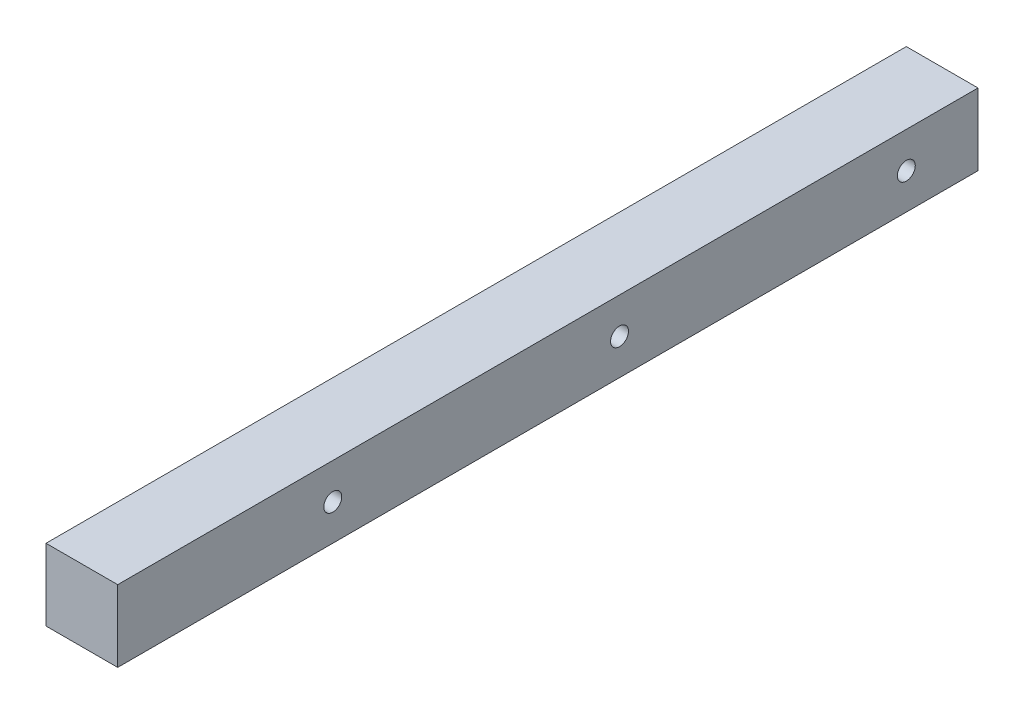
from build123d import *

# Parameters (mm, degrees)
SKETCH7_W           = 25.4
SKETCH7_H           = 25.4
BOSS_EXTRUDE3_DEPTH = 152.4
SKETCH9_R           = 3.175
CUT_EXTRUDE1_DEPTH  = 156.02325632
LPATTERN1_COUNT     = 2
LPATTERN1_PITCH     = 101.6
LPATTERN1_COL_COUNT = 2
LPATTERN1_COL_PITCH = 101.6


with BuildPart() as part:
    # Sketch7 → Boss-Extrude3 (new, symmetric)
    with BuildSketch(Plane.XY):
        Rectangle(SKETCH7_W, SKETCH7_H)
    extrude(amount=BOSS_EXTRUDE3_DEPTH, both=True)

    # Sketch9 → Cut-Extrude1 (cut, through all)
    with BuildSketch(Plane(origin=(12.7, 0, 0), x_dir=(0, -1, 0), z_dir=(-1, 0, 0))):
        with Locations(Location((0, -25.4, 0), (0, 0, 90))):
            Circle(SKETCH9_R)
    cut_extrude1 = extrude(amount=CUT_EXTRUDE1_DEPTH, mode=Mode.SUBTRACT)

    # LPattern1: Cut-Extrude1 ×2
    with Locations(*[(0, 0, -i * LPATTERN1_PITCH) for i in range(1, LPATTERN1_COUNT)]):
        add(cut_extrude1, mode=Mode.SUBTRACT)

    # LPattern1 col: Cut-Extrude1 ×2
    with Locations(*[(0, 0, i * LPATTERN1_COL_PITCH) for i in range(1, LPATTERN1_COL_COUNT)]):
        add(cut_extrude1, mode=Mode.SUBTRACT)


solid = part.part
